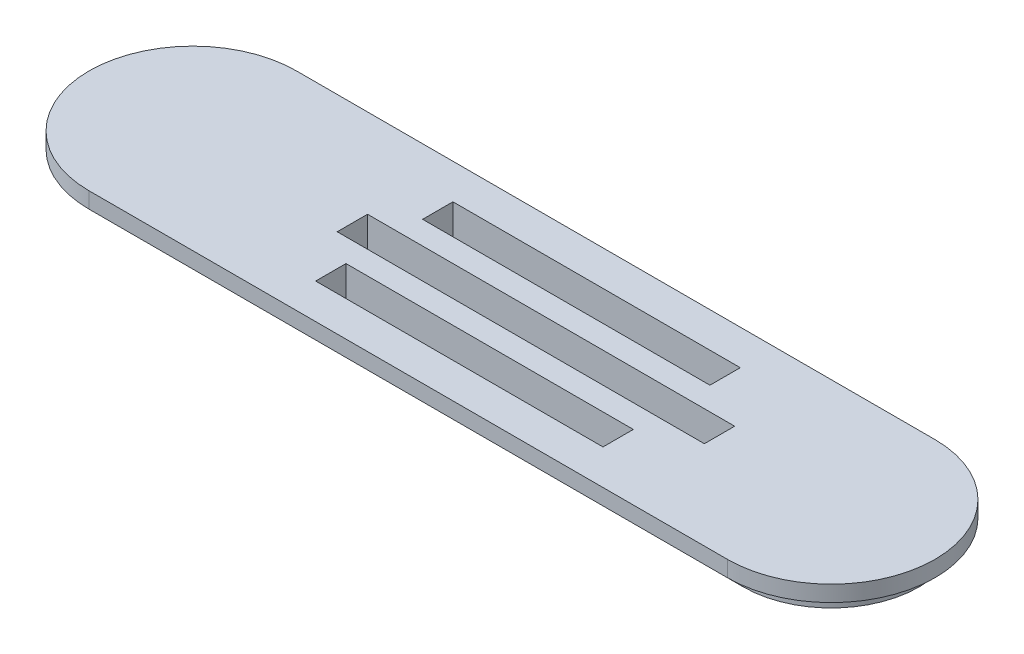
from build123d import *

# Parameters (mm, degrees)
BOSS_EXTRUDE1_DEPTH = 10
CUT_EXTRUDE1_DEPTH  = 5


with BuildPart() as part:
    # Sketch1 → Boss-Extrude1 (new body)
    with BuildSketch(Plane(origin=(0, 0, 0), x_dir=(1, 0, 0), z_dir=(0, 1, 0))):
        with BuildLine():
            Line((-100, 32.5), (100, 32.5))
            ThreePointArc((100, 32.5), (132.5, 0), (100, -32.5))
            Line((100, -32.5), (-100, -32.5))
            ThreePointArc((-100, -32.5), (-132.5, 0), (-100, 32.5))
        make_face()
        Polygon((0, 21.5), (-40, 21.5), (-40, 12), (0, 12), (50, 12), (50, 21.5), align=None, mode=Mode.SUBTRACT)
        Polygon((-50, 4.75), (0, 4.75), (65, 4.75), (65, -4.75), (0, -4.75), (-50, -4.75), align=None, mode=Mode.SUBTRACT)
        Polygon((0, -12), (-40, -12), (-40, -21.5), (0, -21.5), (50, -21.5), (50, -12), align=None, mode=Mode.SUBTRACT)
    extrude(amount=BOSS_EXTRUDE1_DEPTH)

    # Sketch2 → Cut-Extrude1 (cut)
    with BuildSketch(Plane(origin=(0, 0, 0), x_dir=(1, 0, 0), z_dir=(0, 1, 0))):
        with BuildLine():
            Line((-100, 32.5), (100, 32.5))
            ThreePointArc((100, 32.5), (132.5, 0), (100, -32.5))
            Line((100, -32.5), (-100, -32.5))
            ThreePointArc((-100, -32.5), (-132.5, 0), (-100, 32.5))
        make_face()
        with BuildLine():
            Line((-100, 27.5), (100, 27.5))
            ThreePointArc((100, 27.5), (127.5, 0), (100, -27.5))
            Line((100, -27.5), (-100, -27.5))
            ThreePointArc((-100, -27.5), (-127.5, 0), (-100, 27.5))
        make_face(mode=Mode.SUBTRACT)
    extrude(amount=CUT_EXTRUDE1_DEPTH, mode=Mode.SUBTRACT)


solid = part.part
